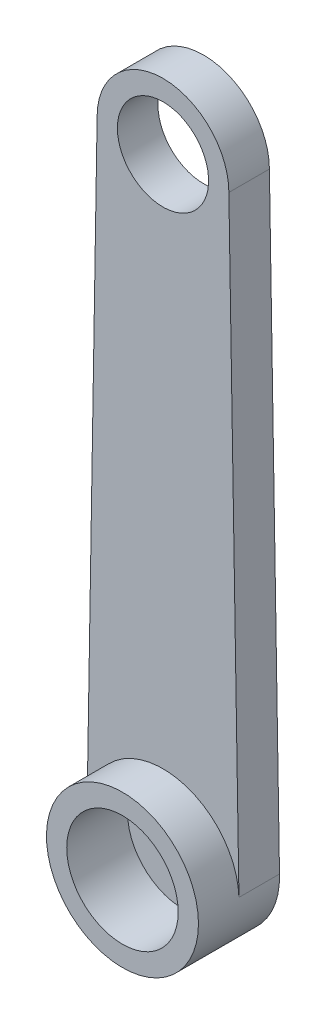
from build123d import *

# Parameters (mm, degrees)
ESQUISSE1_R         = 3.75
ESQUISSE1_R_2       = 2.75
BOSS_EXTRU_1_DEPTH  = 4
SKETCH1_R           = 2.25
BOSS_EXTRUDE1_DEPTH = 2
SKETCH1_3_R         = 2.75
SKETCH1_3_R_2       = 1.5
BOSS_EXTRUDE2_DEPTH = 1


with BuildPart() as part:
    # Esquisse1 → Boss.-Extru.1 (new body)
    with BuildSketch(Plane.XY):
        Circle(ESQUISSE1_R)
        Circle(ESQUISSE1_R_2, mode=Mode.SUBTRACT)
    extrude(amount=BOSS_EXTRU_1_DEPTH)

    # Sketch1 → Boss-Extrude1 (add)
    with BuildSketch(Plane(origin=(0, 0, 0), x_dir=(-1, 0, 0), z_dir=(0, 0, -1))):
        with BuildLine():
            Line((3.747917245, 0.124965287), (3.25, 30))
            ThreePointArc((3.25, 30), (0, 33.25), (-3.25, 30))
            Line((-3.25, 30), (-3.747917245, 0.124965287))
            ThreePointArc((-3.747917245, 0.124965287), (0, 3.75), (3.747917245, 0.124965287))
        make_face()
        with Locations((0, 30)):
            Circle(SKETCH1_R, mode=Mode.SUBTRACT)
    extrude(amount=-BOSS_EXTRUDE1_DEPTH)

    # Sketch1<3> → Boss-Extrude2 (add)
    with BuildSketch(Plane(origin=(0, 0, 0), x_dir=(-1, 0, 0), z_dir=(0, 0, -1))):
        Circle(SKETCH1_3_R)
        Circle(SKETCH1_3_R_2, mode=Mode.SUBTRACT)
    extrude(amount=-BOSS_EXTRUDE2_DEPTH)


solid = part.part
